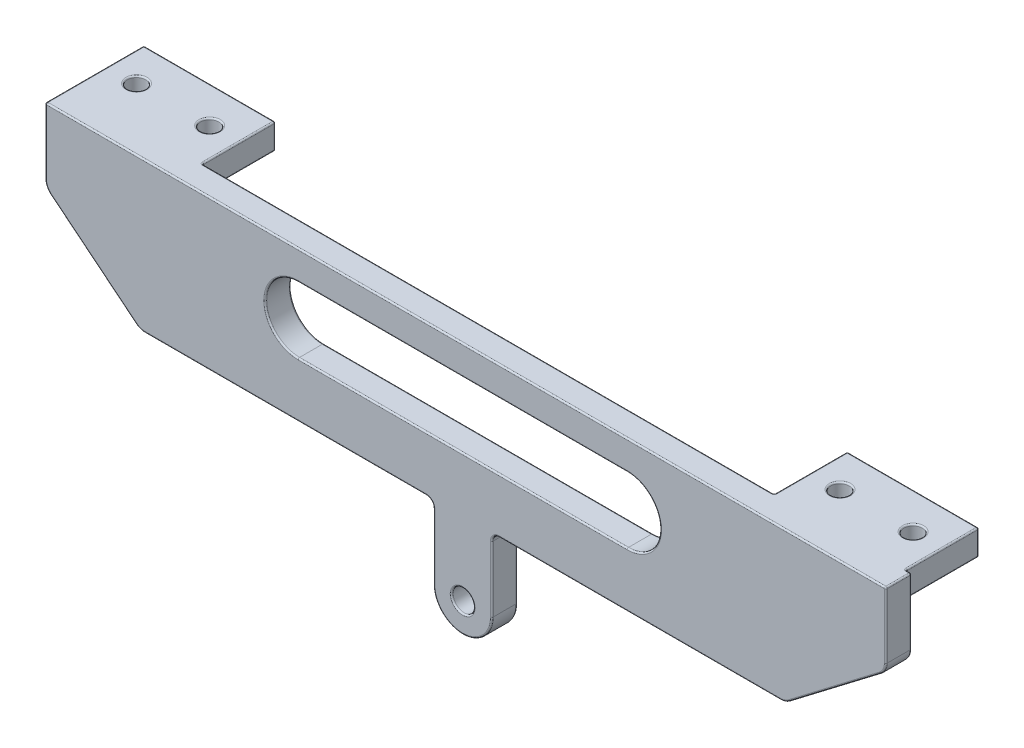
from build123d import *

# Parameters (mm, degrees)
SKETCH6_R           = 1.5
BOSS_EXTRUDE1_DEPTH = 3.5
SKETCH8_W           = 18
SKETCH8_H           = 10
SKETCH8_R           = 1.25
BOSS_EXTRUDE2_DEPTH = 3.5
FILLET1_R           = 2
FILLET2_R           = 1
FILLET3_R           = 0.2


with BuildPart() as part:
    # Sketch6 → Boss-Extrude1 (new body)
    with BuildSketch(Plane.XY):
        with BuildLine():
            Line((-44.142135624, 70), (-4, 70))
            Line((-4, 70), (-4, 60))
            ThreePointArc((-4, 60), (0, 56), (4, 60))
            Line((4, 60), (4, 70))
            Line((4, 70), (44.142135624, 70))
            Line((44.142135624, 70), (57.891444233, 80.5))
            Line((57.891444233, 80.5), (57.891444233, 90.5))
            Line((57.891444233, 90.5), (-57.108555767, 90.5))
            Line((-57.108555767, 90.5), (-57.108555767, 80.5))
            Line((-57.108555767, 80.5), (-44.142135624, 70))
        make_face()
        with Locations((0, 60)):
            Circle(SKETCH6_R, mode=Mode.SUBTRACT)
        with BuildLine():
            Line((22.5, 86.5), (-22.5, 86.5))
            ThreePointArc((-22.5, 86.5), (-27, 82), (-22.5, 77.5))
            Line((-22.5, 77.5), (22.5, 77.5))
            ThreePointArc((22.5, 77.5), (27, 82), (22.5, 86.5))
        make_face(mode=Mode.SUBTRACT)
    extrude(amount=BOSS_EXTRUDE1_DEPTH)

    # Sketch8 → Boss-Extrude2 (add)
    # profile 1 of 2: a face of its own
    with BuildSketch(Plane(origin=(0, 90.5, 0), x_dir=(1, 0, 0), z_dir=(0, 1, 0))):
        with Locations((-48.108555767, 5)):
            Rectangle(SKETCH8_W, SKETCH8_H)
        with Locations(Location((-53.108555767, 5, 0), (0, 0, 180))):
            Circle(SKETCH8_R, mode=Mode.SUBTRACT)
        with Locations(Location((-43.108555767, 5, 0), (0, 0, 180))):
            Circle(SKETCH8_R, mode=Mode.SUBTRACT)
    # profile 2 of 2: a face of its own
    with BuildSketch(Plane(origin=(0, 90.5, 0), x_dir=(1, 0, 0), z_dir=(0, 1, 0))):
        with Locations((48.108555767, 5)):
            Rectangle(SKETCH8_W, SKETCH8_H)
        with Locations((43.108555767, 5)):
            Circle(SKETCH8_R, mode=Mode.SUBTRACT)
        with Locations((53.108555767, 5)):
            Circle(SKETCH8_R, mode=Mode.SUBTRACT)
    extrude(amount=-BOSS_EXTRUDE2_DEPTH)

    # Fillet1
    fillet1_edges = [part.edges().sort_by_distance(p)[0] for p in [
        (-57.108555767, 80.5, 1.75),
        (57.891444233, 80.5, 1.75),
        (44.142135624, 70, 1.75),
        (-44.142135624, 70, 1.75),
    ]]
    fillet(fillet1_edges, radius=FILLET1_R)

    # Fillet2
    fillet2_edges = [part.edges().sort_by_distance(p)[0] for p in [
        (4, 70, 1.75),
        (-4, 70, 1.75),
    ]]
    fillet(fillet2_edges, radius=FILLET2_R)

    # Fillet3
    fillet3_edges = [part.edges().sort_by_distance(p)[0] for p in [
        (-4, 64.5, 0),
        (-4, 64.5, 3.5),
        (24.232897128, 70, 0),
        (24.232897128, 70, 3.5),
        (57.5, 90.5, 0),
        (-4.292893219, 69.707106781, 0),
        (-4.292893219, 69.707106781, 3.5),
        (4.292893219, 69.707106781, 0),
        (4.292893219, 69.707106781, 3.5),
        (4, 64.5, 0),
        (0, 56, 0),
        (0, 56, 3.5),
        (-57.108555767, 90.5, -3.25),
        (57.891444233, 90.5, 1.75),
        (4, 64.5, 3.5),
        (-1.5, 60, 0),
        (-1.5, 60, 3.5),
        (-27, 82, 0),
        (0, 77.5, 0),
        (27, 82, 0),
        (0, 86.5, 0),
        (-27, 82, 3.5),
        (0, 77.5, 3.5),
        (27, 82, 3.5),
        (0, 86.5, 3.5),
        (0.391444233, 90.5, 3.5),
        (-57.108555767, 85.976975533, 3.5),
        (-57.108555767, 84.226975533, 0),
        (-57.108555767, 87, -5),
        (-48.108555767, 87, -10),
        (-57.108555767, 88.75, -10),
        (-39.108555767, 87, -5),
        (-39.108555767, 88.75, -10),
        (-48.108555767, 87, 0),
        (-39.108555767, 88.75, 0),
        (-41.858555767, 87, -5),
        (-51.858555767, 87, -5),
        (-39.108555767, 90.5, -5),
        (-48.108555767, 90.5, -10),
        (-51.858555767, 90.5, -5),
        (-41.858555767, 90.5, -5),
        (0, 90.5, 0),
        (48.108555767, 87, 0),
        (57.108555767, 88.75, 0),
        (39.108555767, 87, -5),
        (39.108555767, 88.75, 0),
        (48.108555767, 87, -10),
        (39.108555767, 88.75, -10),
        (57.108555767, 87, -5),
        (57.108555767, 88.75, -10),
        (51.858555767, 87, -5),
        (41.858555767, 87, -5),
        (57.108555767, 90.5, -5),
        (48.108555767, 90.5, -10),
        (39.108555767, 90.5, -5),
        (41.858555767, 90.5, -5),
        (51.858555767, 90.5, -5),
        (57.891444233, 85.994577653, 0),
        (57.891444233, 85.994577653, 3.5),
        (50.892485005, 75.155071467, 0),
        (-24.216949239, 70, 0),
        (-50.529867905, 75.17268361, 0),
        (-56.913726336, 80.592928872, 0),
        (-44.101512197, 70.114717018, 0),
        (44.106492168, 70.105400785, 0),
        (57.684170023, 80.602513192, 0),
        (50.892485005, 75.155071467, 3.5),
        (-50.529867905, 75.17268361, 3.5),
        (-24.216949239, 70, 3.5),
        (-56.913726336, 80.592928872, 3.5),
        (-44.101512197, 70.114717018, 3.5),
        (44.106492168, 70.105400785, 3.5),
        (57.684170023, 80.602513192, 3.5),
    ]]
    fillet(fillet3_edges, radius=FILLET3_R)


solid = part.part
